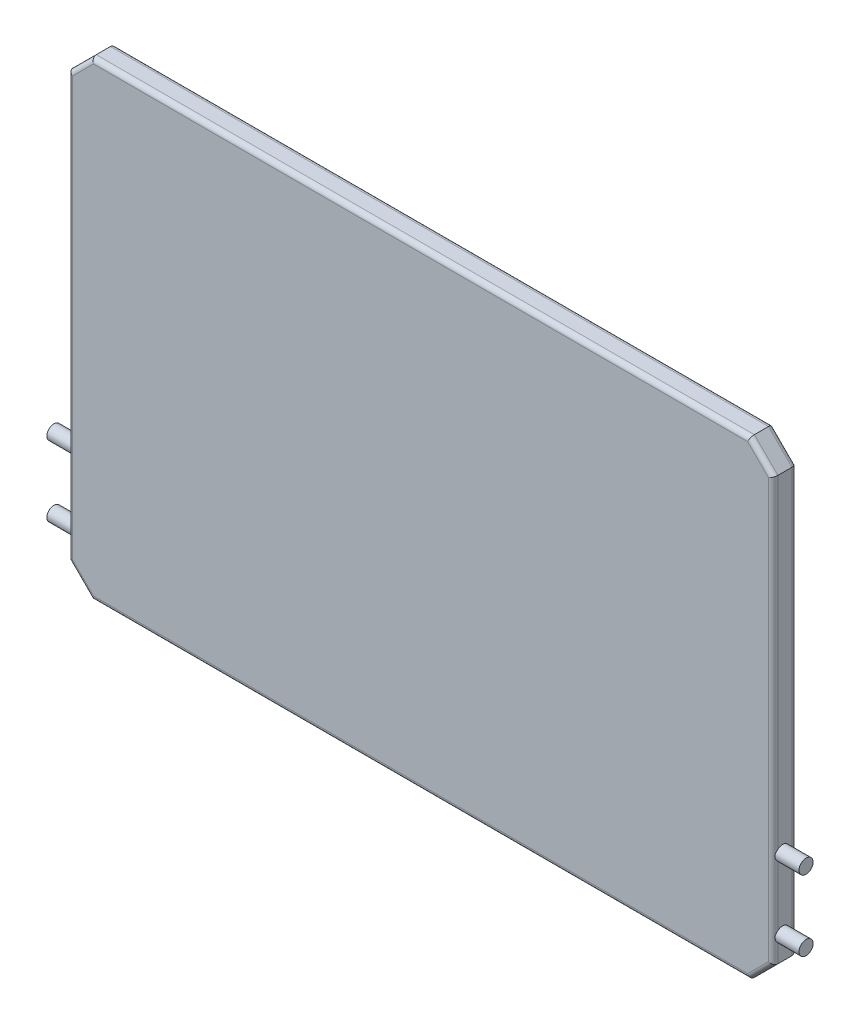
from build123d import *

# Parameters (mm, degrees)
SKETCH1_W           = 3000
SKETCH1_H           = 2000
BOSS_EXTRUDE1_DEPTH = 50
CHAMFER1_SIZE       = 100
FILLET1_R           = 20
SKETCH3_R           = 30
BOSS_EXTRUDE2_DEPTH = 1600


with BuildPart() as part:
    # Sketch1 → Boss-Extrude1 (new, symmetric)
    with BuildSketch(Plane.XY):
        Rectangle(SKETCH1_W, SKETCH1_H)
    extrude(amount=BOSS_EXTRUDE1_DEPTH, both=True)

    # Chamfer1
    chamfer1_edges = [part.edges().sort_by_distance(p)[0] for p in [
        (-1500, 1000, 0),
        (1500, 1000, 0),
        (1500, -1000, 0),
        (-1500, -1000, 0),
    ]]
    chamfer(chamfer1_edges, length=CHAMFER1_SIZE)

    # Fillet1
    fillet1_edges = [part.edges().sort_by_distance(p)[0] for p in [
        (0, -1000, -50),
        (0, -1000, 50),
        (-1500, 0, -50),
        (0, 1000, -50),
        (1500, 0, -50),
        (-1450, 950, -50),
        (1450, 950, -50),
        (1450, -950, -50),
        (-1450, -950, -50),
        (-1500, 0, 50),
        (1500, 0, 50),
        (0, 1000, 50),
        (-1450, 950, 50),
        (1450, 950, 50),
        (1450, -950, 50),
        (-1450, -950, 50),
    ]]
    fillet(fillet1_edges, radius=FILLET1_R)

    # Sketch3 → Boss-Extrude2 (add, symmetric)
    with BuildSketch(Plane(origin=(0, 0, 0), x_dir=(0, 0, -1), z_dir=(1, 0, 0))):
        with Locations(Location((-10, -500, 0), (0, 0, 228.189685104))):
            Circle(SKETCH3_R)
        with Locations(Location((-10, -800, 0), (0, 0, 180))):
            Circle(SKETCH3_R)
    extrude(amount=BOSS_EXTRUDE2_DEPTH, both=True)


solid = part.part
